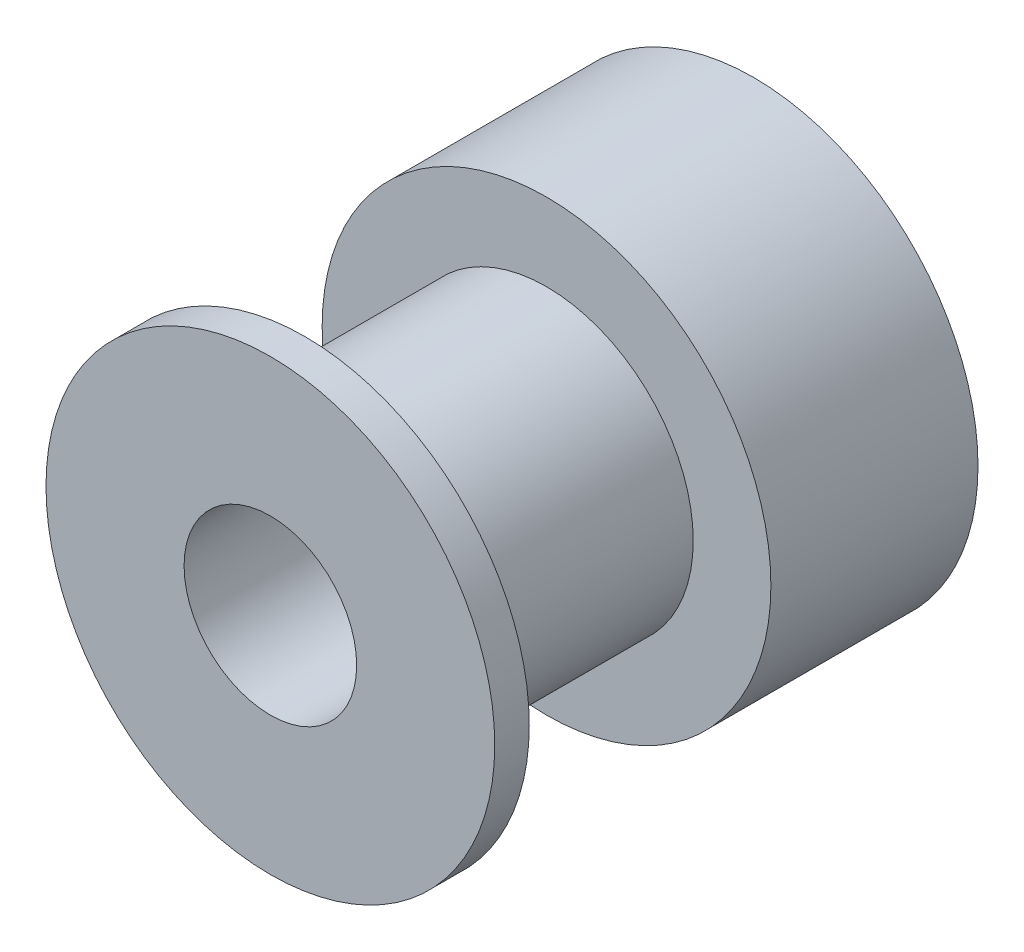
from build123d import *

# Parameters (mm, degrees)
SKETCH_1_R          = 6.5
EXTRUDE_1_DEPTH     = 6
SKETCH_2_R          = 4.25
EXTRUDE_2_DEPTH     = 7
SKETCH_3_R          = 6.5
EXTRUDE_3_DEPTH     = 1
SKETCH_4_R          = 2.5
CUT_EXTRUDE_1_DEPTH = 34
SKETCH_5_R          = 1.5
CUT_EXTRUDE_2_DEPTH = 10
SKETCH_6_R          = 1.5
CUT_EXTRUDE_3_DEPTH = 10


with BuildPart() as part:
    # 草图1 → 凸台-拉伸1 (new body)
    with BuildSketch(Plane.XY):
        Circle(SKETCH_1_R)
    extrude(amount=EXTRUDE_1_DEPTH)

    # 草图2 → 凸台-拉伸2 (add)
    with BuildSketch(Plane.XY.offset(6)):
        Circle(SKETCH_2_R)
    extrude(amount=EXTRUDE_2_DEPTH)

    # 草图3 → 凸台-拉伸3 (add)
    with BuildSketch(Plane.XY.offset(13)):
        Circle(SKETCH_3_R)
    extrude(amount=EXTRUDE_3_DEPTH)

    # 草图4 → 切除-拉伸1 (cut)
    with BuildSketch(Plane.XY.offset(14)):
        Circle(SKETCH_4_R)
    extrude(amount=-CUT_EXTRUDE_1_DEPTH, mode=Mode.SUBTRACT)

    # 草图5 → 切除-拉伸2 (cut)
    with BuildSketch(Plane(origin=(0, 0, 0), x_dir=(1, 0, 0), z_dir=(0, 1, 0))):
        with Locations(Location((0, -3, 0), (0, 0, 270))):
            Circle(SKETCH_5_R)
    extrude(amount=-CUT_EXTRUDE_2_DEPTH, mode=Mode.SUBTRACT)

    # 草图6 → 切除-拉伸3 (cut)
    with BuildSketch(Plane(origin=(0, 0, 0), x_dir=(0, 0, -1), z_dir=(1, 0, 0))):
        with Locations((-3, 0)):
            Circle(SKETCH_6_R)
    extrude(amount=-CUT_EXTRUDE_3_DEPTH, mode=Mode.SUBTRACT)


solid = part.part
